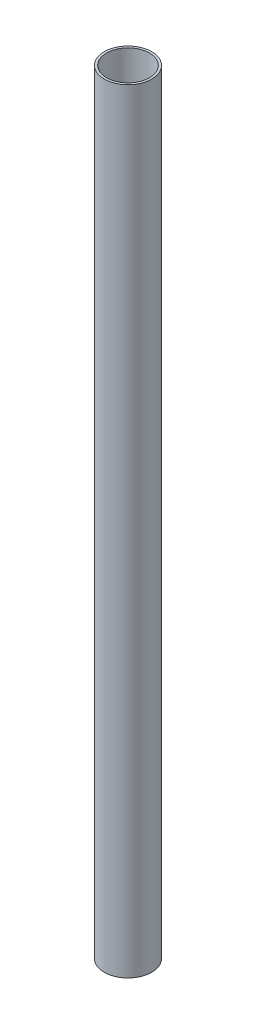
from build123d import *

# Parameters (mm, degrees)
SKETCH1_R           = 12.7
SKETCH1_R_2         = 11.4935
BOSS_EXTRUDE1_DEPTH = 414.02


with BuildPart() as part:
    # Sketch1 → Boss-Extrude1 (new body)
    with BuildSketch(Plane(origin=(0, 0, 0), x_dir=(1, 0, 0), z_dir=(0, 1, 0))):
        with Locations(Location((0, 0, 0), (0, 0, 270))):
            Circle(SKETCH1_R)
        with Locations(Location((0, 0, 0), (0, 0, 270))):
            Circle(SKETCH1_R_2, mode=Mode.SUBTRACT)
    extrude(amount=BOSS_EXTRUDE1_DEPTH)


solid = part.part
